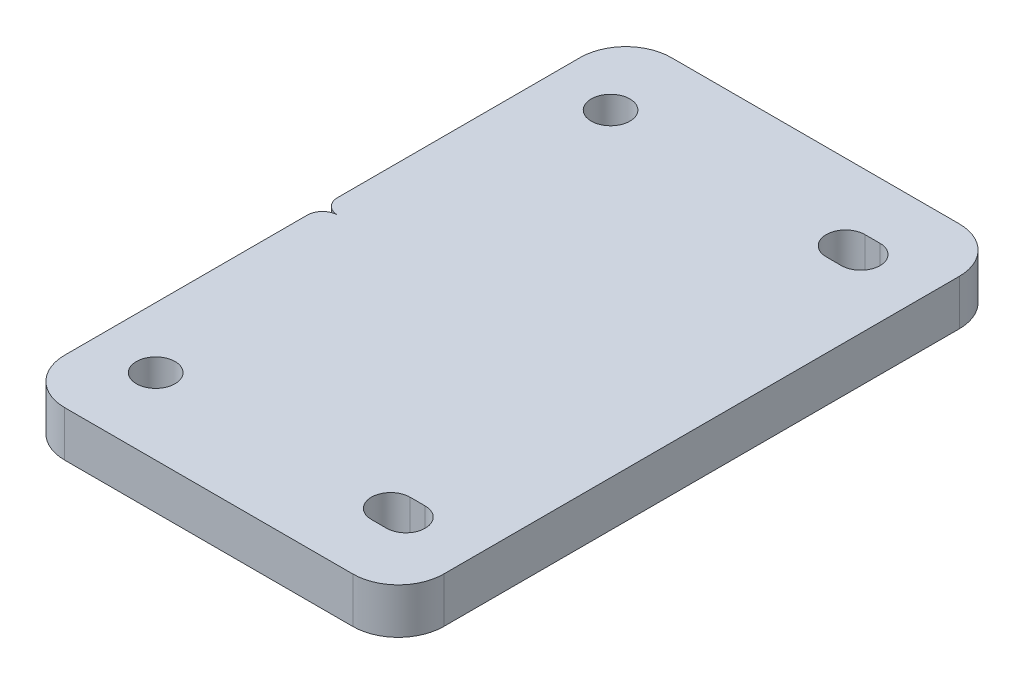
from build123d import *

# Parameters (mm, degrees)
EXTRUDE_1_DEPTH     = 6
SKETCH_2_R          = 2.55
CUT_EXTRUDE_1_DEPTH = 48.549973712
CUT_EXTRUDE_2_DEPTH = 48.549973712


with BuildPart() as part:
    # Эскиз1 → Бобышка-Вытянуть1 (new body)
    with BuildSketch(Plane(origin=(0, 0, 0), x_dir=(1, 0, 0), z_dir=(0, 1, 0))):
        with BuildLine():
            Line((-19, -40), (19, -40))
            ThreePointArc((19, -40), (23.242640687, -38.242640687), (25, -34))
            Line((25, -34), (25, 34))
            ThreePointArc((25, 34), (23.242640687, 38.242640687), (19, 40))
            Line((19, 40), (-19, 40))
            ThreePointArc((-19, 40), (-23.242640687, 38.242640687), (-25, 34))
            Line((-25, 34), (-25, -34))
            ThreePointArc((-25, -34), (-23.242640687, -38.242640687), (-19, -40))
        make_face()
    extrude(amount=EXTRUDE_1_DEPTH)

    # Эскиз2 → Вырез-Вытянуть1 (cut, through all)
    with BuildSketch(Plane.XZ):
        with Locations(Location((-17, -30, 0), (0, 0, 270))):
            Circle(SKETCH_2_R)
        with Locations(Location((-17, 30, 0), (0, 0, 90))):
            Circle(SKETCH_2_R)
        with BuildLine():
            Line((16, -32.55), (14, -32.55))
            ThreePointArc((14, -32.55), (11.45, -30), (14, -27.45))
            Line((14, -27.45), (16, -27.45))
            ThreePointArc((16, -27.45), (18.55, -30), (16, -32.55))
        make_face()
        with BuildLine():
            Line((16, 32.55), (14, 32.55))
            ThreePointArc((14, 32.55), (11.45, 30), (14, 27.45))
            Line((14, 27.45), (16, 27.45))
            ThreePointArc((16, 27.45), (18.55, 30), (16, 32.55))
        make_face()
    extrude(amount=-CUT_EXTRUDE_1_DEPTH, mode=Mode.SUBTRACT)

    # Эскиз3 → Вырез-Вытянуть2 (cut, through all)
    with BuildSketch(Plane.XZ):
        with BuildLine():
            Line((-25, -2), (-25, 2))
            ThreePointArc((-25, 2), (-24.414213562, 0.585786438), (-23, 0))
            ThreePointArc((-23, 0), (-24.414213562, -0.585786438), (-25, -2))
        make_face()
    extrude(amount=-CUT_EXTRUDE_2_DEPTH, mode=Mode.SUBTRACT)


solid = part.part
